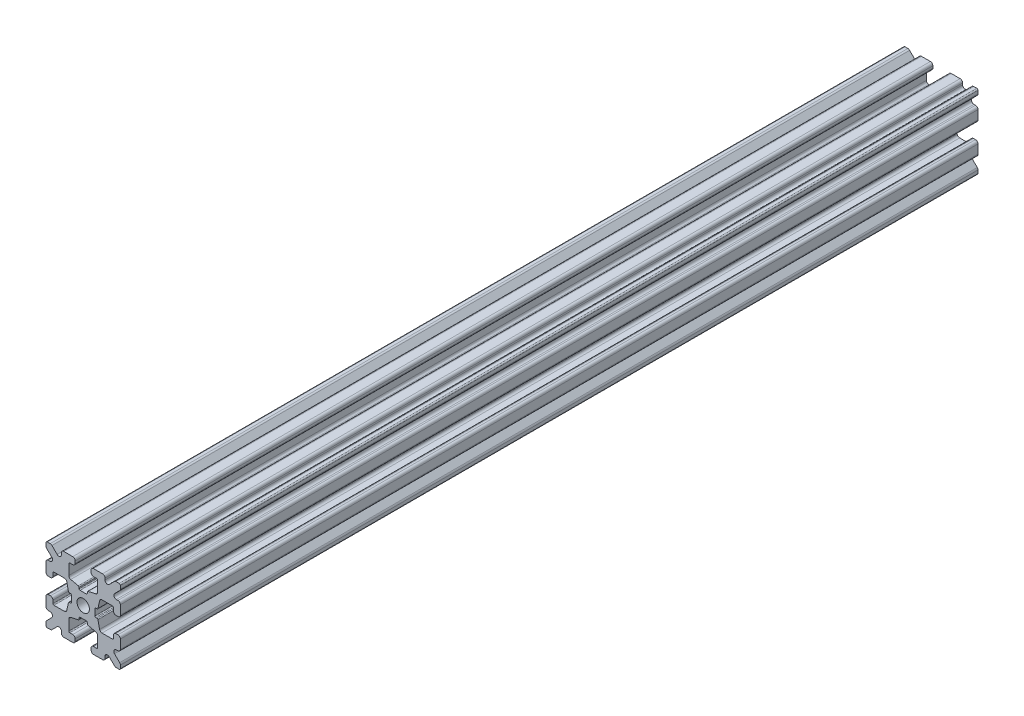
from build123d import *

# Parameters (mm, degrees)
SKETCH1_W           = 15
SKETCH1_H           = 15
SKETCH1_R           = 1.25
BOSS_EXTRUDE1_DEPTH = 86.5
FILLET1_R           = 0.25
CUT_EXTRUDE1_DEPTH  = 174.324839535
CUT_EXTRUDE3_DEPTH  = 174.324839535
FILLET3_R           = 0.5
FILLET4_R           = 0.5
FILLET5_R           = 3
FILLET6_R           = 0.2
CUT_EXTRUDE4_DEPTH  = 174.324839535
FILLET8_R           = 0.5
SKETCH6_W           = 5.1529354
SKETCH6_H           = 1.651
SKETCH6_W_2         = 1.651
SKETCH6_H_2         = 5.1529354
CUT_EXTRUDE5_DEPTH  = 174.324839535
FILLET10_R          = 0.2


with BuildPart() as part:
    # Sketch1 → Boss-Extrude1 (new, symmetric)
    with BuildSketch(Plane.XY):
        Rectangle(SKETCH1_W, SKETCH1_H)
        Circle(SKETCH1_R, mode=Mode.SUBTRACT)
    extrude(amount=BOSS_EXTRUDE1_DEPTH, both=True)

    # Fillet1
    fillet1_edges = [part.edges().sort_by_distance(p)[0] for p in [
        (7.5, -7.5, 0),
        (-7.5, -7.5, 0),
        (-7.5, 7.5, 0),
        (7.5, 7.5, 0),
    ]]
    fillet(fillet1_edges, radius=FILLET1_R)

    # Sketch2 → Cut-Extrude1 (cut, through all)
    with BuildSketch(Plane.XY.offset(86.5)):
        Polygon((-7.5, 1.6), (-6.1, 1.6), (-6.1, 2.9), (-3.4, 2.9), (-3.4, -2.9), (-6.1, -2.9), (-6.1, -1.6), (-7.5, -1.6), align=None)
        Polygon((2.9, 6.1), (1.6, 6.1), (1.6, 7.5), (-1.6, 7.5), (-1.6, 6.1), (-2.9, 6.1), (-2.9, 3.4), (2.9, 3.4), align=None)
        Polygon((-1.6, -7.5), (-1.6, -6.1), (-2.9, -6.1), (-2.9, -3.4), (2.9, -3.4), (2.9, -6.1), (1.6, -6.1), (1.6, -7.5), align=None)
        Polygon((6.1, -2.9), (6.1, -1.6), (7.5, -1.6), (7.5, 1.6), (6.1, 1.6), (6.1, 2.9), (3.4, 2.9), (3.4, -2.9), align=None)
    extrude(amount=-CUT_EXTRUDE1_DEPTH, mode=Mode.SUBTRACT)

    # Sketch4 → Cut-Extrude3 (cut, through all)
    with BuildSketch(Plane.XY.offset(86.5)):
        Polygon((-3.4, 2.9), (-2.75, 0), (-3.4, -2.9), align=None)
        Polygon((-2.9, 3.4), (0, 2.75), (2.9, 3.4), align=None)
        Polygon((3.4, 2.9), (2.75, 0), (3.4, -2.9), align=None)
        Polygon((-2.9, -3.4), (0, -2.75), (2.9, -3.4), align=None)
    extrude(amount=-CUT_EXTRUDE3_DEPTH, mode=Mode.SUBTRACT)

    # Fillet3
    fillet3_edges = [part.edges().sort_by_distance(p)[0] for p in [
        (1.6, -7.5, 0),
        (-1.6, -7.5, 0),
        (-1.6, -6.1, 0),
        (1.6, -6.1, 0),
        (6.1, 1.6, 0),
        (7.5, 1.6, 0),
        (7.5, -1.6, 0),
        (6.1, -1.6, 0),
        (-7.5, -1.6, 0),
        (-7.5, 1.6, 0),
        (-6.1, 1.6, 0),
        (-6.1, -1.6, 0),
        (-1.6, 6.1, 0),
        (-1.6, 7.5, 0),
        (1.6, 7.5, 0),
        (1.6, 6.1, 0),
    ]]
    fillet(fillet3_edges, radius=FILLET3_R)

    # Fillet4
    fillet4_edges = [part.edges().sort_by_distance(p)[0] for p in [
        (-2.9, -3.4, 0),
        (2.9, -3.4, 0),
        (3.4, -2.9, 0),
        (3.4, 2.9, 0),
        (-3.4, 2.9, 0),
        (-3.4, -2.9, 0),
        (2.9, 3.4, 0),
        (-2.9, 3.4, 0),
    ]]
    fillet(fillet4_edges, radius=FILLET4_R)

    # Fillet5
    fillet5_edges = [part.edges().sort_by_distance(p)[0] for p in [
        (-2.75, 0, 0),
        (0, 2.75, 0),
        (2.75, 0, 0),
        (0, -2.75, 0),
    ]]
    fillet(fillet5_edges, radius=FILLET5_R)

    # Fillet6
    fillet6_edges = [part.edges().sort_by_distance(p)[0] for p in [
        (-2.9, -6.1, 0),
        (2.9, -6.1, 0),
        (6.1, -2.9, 0),
        (6.1, 2.9, 0),
        (-6.1, 2.9, 0),
        (-6.1, -2.9, 0),
        (2.9, 6.1, 0),
        (-2.9, 6.1, 0),
    ]]
    fillet(fillet6_edges, radius=FILLET6_R)

    # Sketch5 → Cut-Extrude4 (cut, through all)
    with BuildSketch(Plane.XY.offset(86.5)):
        Polygon((-7.5, 6.439339828), (-5.460660172, 4.4), (-7.5, 4.4), align=None)
        Polygon((-6.439339828, 7.5), (-4.4, 5.460660172), (-4.4, 7.5), align=None)
        Polygon((4.4, 7.5), (6.439339828, 7.5), (4.4, 5.460660172), align=None)
        Polygon((7.5, 6.439339828), (7.5, 4.4), (5.460660172, 4.4), align=None)
        Polygon((7.5, -6.439339828), (5.460660172, -4.4), (7.5, -4.4), align=None)
        Polygon((6.439339828, -7.5), (4.4, -5.460660172), (4.4, -7.5), align=None)
        Polygon((-4.4, -7.5), (-6.439339828, -7.5), (-4.4, -5.460660172), align=None)
        Polygon((-7.5, -6.439339828), (-7.5, -4.4), (-5.460660172, -4.4), align=None)
    extrude(amount=-CUT_EXTRUDE4_DEPTH, mode=Mode.SUBTRACT)

    # Fillet8
    fillet8_edges = [part.edges().sort_by_distance(p)[0] for p in [
        (-7.5, 4.4, 0),
        (-7.5, 6.439339828, 0),
        (-5.460660172, 4.4, 0),
        (7.5, -4.4, 0),
        (7.5, -6.439339828, 0),
        (5.460660172, -4.4, 0),
        (5.460660172, 4.4, 0),
        (7.5, 6.439339828, 0),
        (7.5, 4.4, 0),
        (-4.4, 7.5, 0),
        (-4.4, 5.460660172, 0),
        (-6.439339828, 7.5, 0),
        (-5.460660172, -4.4, 0),
        (-7.5, -6.439339828, 0),
        (-7.5, -4.4, 0),
        (4.4, 5.460660172, 0),
        (4.4, 7.5, 0),
        (6.439339828, 7.5, 0),
        (6.439339828, -7.5, 0),
        (4.4, -7.5, 0),
        (4.4, -5.460660172, 0),
        (-6.439339828, -7.5, 0),
        (-4.4, -5.460660172, 0),
        (-4.4, -7.5, 0),
    ]]
    fillet(fillet8_edges, radius=FILLET8_R)

    # Sketch6 → Cut-Extrude5 (cut, through all)
    with BuildSketch(Plane.XY.offset(86.5)):
        with Locations((4.9235323, 0)):
            Rectangle(SKETCH6_W, SKETCH6_H)
        with Locations((0, -4.9235323)):
            Rectangle(SKETCH6_W_2, SKETCH6_H_2)
        with Locations((-4.9235323, 0)):
            Rectangle(SKETCH6_W, SKETCH6_H)
        with Locations((0, 4.9235323)):
            Rectangle(SKETCH6_W_2, SKETCH6_H_2)
    extrude(amount=-CUT_EXTRUDE5_DEPTH, mode=Mode.SUBTRACT)

    # Fillet10
    fillet10_edges = [part.edges().sort_by_distance(p)[0] for p in [
        (0.8255, -2.935025862, 0),
        (-0.8255, -2.935025862, 0),
        (0.8255, -2.3470646, 0),
        (-0.8255, -2.3470646, 0),
        (2.935025862, 0.8255, 0),
        (2.935025862, -0.8255, 0),
        (2.3470646, 0.8255, 0),
        (2.3470646, -0.8255, 0),
        (-2.935025862, -0.8255, 0),
        (-2.935025862, 0.8255, 0),
        (-2.3470646, -0.8255, 0),
        (-2.3470646, 0.8255, 0),
        (-0.8255, 2.935025862, 0),
        (0.8255, 2.935025862, 0),
        (-0.8255, 2.3470646, 0),
        (0.8255, 2.3470646, 0),
    ]]
    fillet(fillet10_edges, radius=FILLET10_R)


solid = part.part
